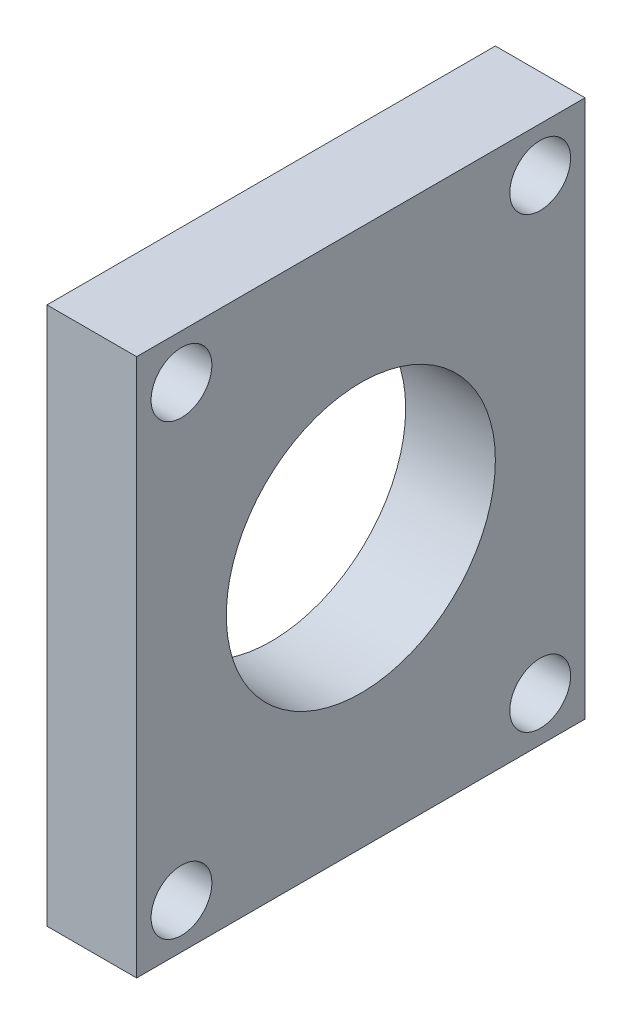
from build123d import *

# Parameters (mm, degrees)
SKETCH1_W           = 31.75
SKETCH1_H           = 38.1
BOSS_EXTRUDE1_DEPTH = 3.175
SKETCH2_R           = 2.15265
CUT_EXTRUDE1_DEPTH  = 42.760604941
SKETCH3_R           = 9.525
CUT_EXTRUDE2_DEPTH  = 42.760604941


with BuildPart() as part:
    # Sketch1 → Boss-Extrude1 (new, symmetric)
    with BuildSketch(Plane(origin=(0, 0, 0), x_dir=(0, 0, -1), z_dir=(1, 0, 0))):
        with Locations((0, 19.05)):
            Rectangle(SKETCH1_W, SKETCH1_H)
    extrude(amount=BOSS_EXTRUDE1_DEPTH, both=True)

    # Sketch2 → Cut-Extrude1 (cut, through all)
    with BuildSketch(Plane(origin=(3.175, 0, 0), x_dir=(0, 0, -1), z_dir=(1, 0, 0))):
        with Locations((-12.7, 3.175)):
            Circle(SKETCH2_R)
        with Locations((-12.7, 34.925)):
            Circle(SKETCH2_R)
        with Locations((12.7, 3.175)):
            Circle(SKETCH2_R)
        with Locations((12.7, 34.925)):
            Circle(SKETCH2_R)
    extrude(amount=-CUT_EXTRUDE1_DEPTH, mode=Mode.SUBTRACT)

    # Sketch3 → Cut-Extrude2 (cut, through all)
    with BuildSketch(Plane(origin=(3.175, 0, 0), x_dir=(0, 0, -1), z_dir=(1, 0, 0))):
        with Locations((0, 19.05)):
            Circle(SKETCH3_R)
    extrude(amount=-CUT_EXTRUDE2_DEPTH, mode=Mode.SUBTRACT)


solid = part.part
